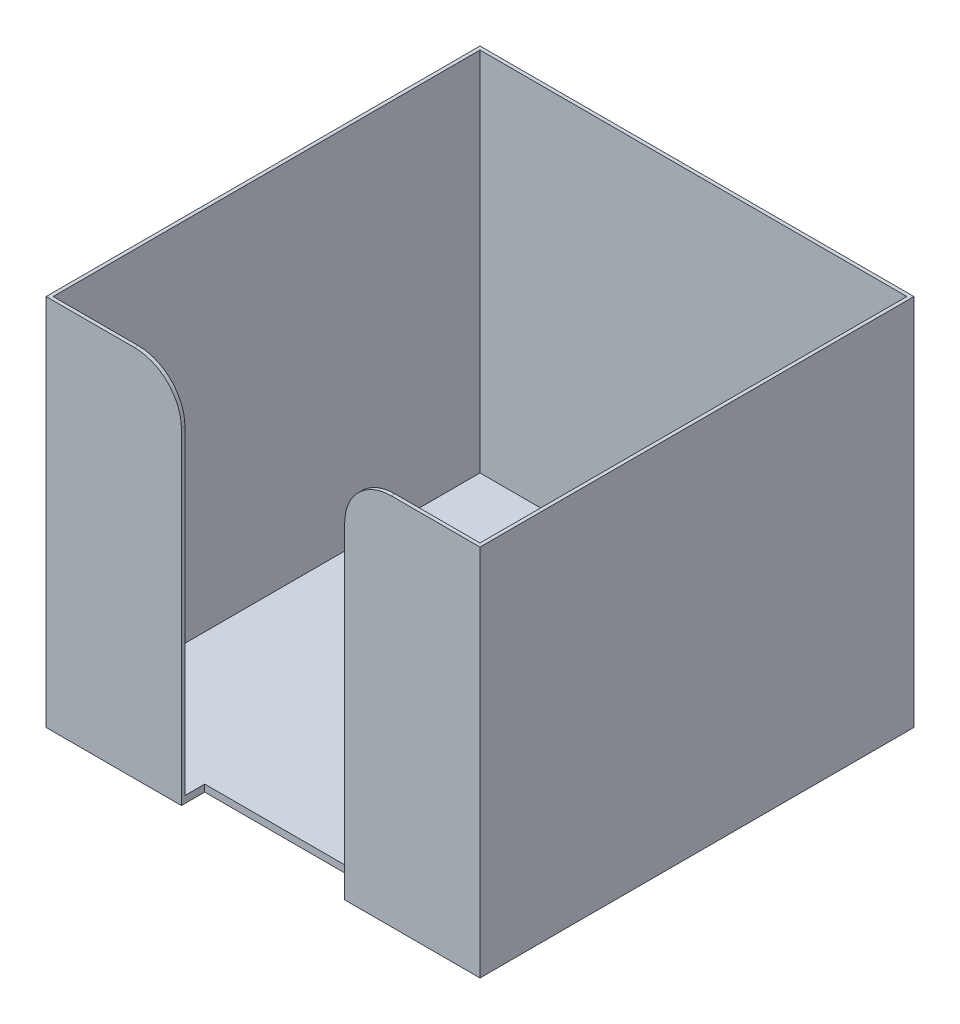
from build123d import *

# Parameters (mm, degrees)
SKETCH2_W           = 93
SKETCH2_H           = 93
BOSS_EXTRUDE2_DEPTH = 80
SKETCH3_W           = 91.5
SKETCH3_H           = 91.5
CUT_EXTRUDE1_DEPTH  = 78.5
SKETCH6_W           = 35
SKETCH6_H           = 80
CUT_EXTRUDE2_DEPTH  = 5
FILLET1_R           = 10
FILLET2_R           = 10


with BuildPart() as part:
    # Sketch2 → Boss-Extrude2 (new body)
    with BuildSketch(Plane(origin=(0, 0, 0), x_dir=(1, 0, 0), z_dir=(0, 1, 0))):
        Rectangle(SKETCH2_W, SKETCH2_H)
    extrude(amount=BOSS_EXTRUDE2_DEPTH)

    # Sketch3 → Cut-Extrude1 (cut)
    with BuildSketch(Plane(origin=(0, 80, 0), x_dir=(1, 0, 0), z_dir=(0, 1, 0))):
        Rectangle(SKETCH3_W, SKETCH3_H)
    extrude(amount=-CUT_EXTRUDE1_DEPTH, mode=Mode.SUBTRACT)

    # Sketch6 → Cut-Extrude2 (cut)
    with BuildSketch(Plane.XY.offset(46.5)):
        with Locations((0, 40)):
            Rectangle(SKETCH6_W, SKETCH6_H)
    extrude(amount=-CUT_EXTRUDE2_DEPTH, mode=Mode.SUBTRACT)

    # Fillet1
    fillet1_edges = [part.edges().sort_by_distance(p)[0] for p in [
        (-17.5, 80, 46.125),
    ]]
    fillet(fillet1_edges, radius=FILLET1_R)

    # Fillet2
    fillet2_edges = [part.edges().sort_by_distance(p)[0] for p in [
        (17.5, 80, 46.125),
    ]]
    fillet(fillet2_edges, radius=FILLET2_R)


solid = part.part
